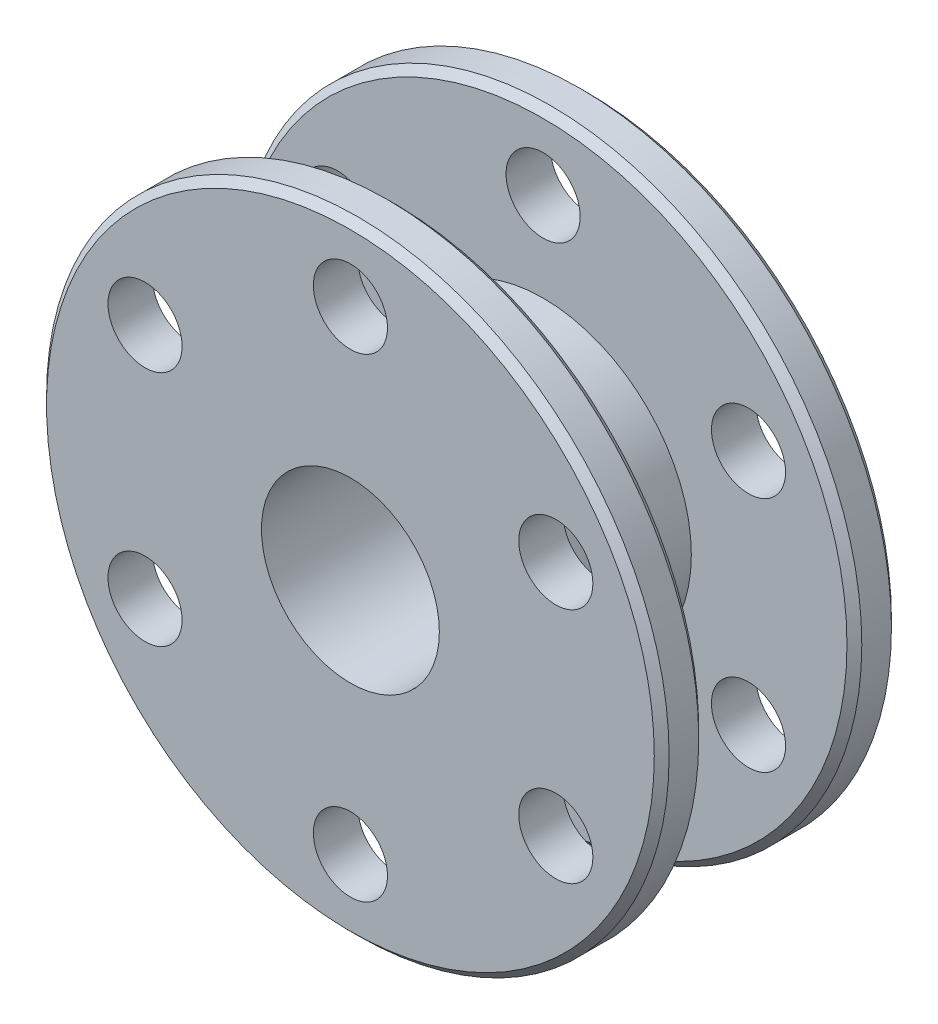
from build123d import *

# Parameters (mm, degrees)
SKETCH1_R           = 10
SKETCH1_R_2         = 6
BOSS_EXTRUDE1_DEPTH = 16
SKETCH1_3_R         = 21
SKETCH1_3_R_2       = 2.5
SKETCH1_3_R_3       = 10
BOSS_EXTRUDE2_DEPTH = 3
CHAMFER1_SIZE       = 0.5


with BuildPart() as part:
    # Sketch1 → Boss-Extrude1 (new body)
    with BuildSketch(Plane.XY):
        Circle(SKETCH1_R)
        Circle(SKETCH1_R_2, mode=Mode.SUBTRACT)
    extrude(amount=BOSS_EXTRUDE1_DEPTH)

    # Sketch1<3> → Boss-Extrude2 (add)
    with BuildSketch(Plane.XY):
        Circle(SKETCH1_3_R)
        with Locations((0, -16)):
            Circle(SKETCH1_3_R_2, mode=Mode.SUBTRACT)
        with Locations((-13.856406461, -8)):
            Circle(SKETCH1_3_R_2, mode=Mode.SUBTRACT)
        with Locations((13.856406461, -8)):
            Circle(SKETCH1_3_R_2, mode=Mode.SUBTRACT)
        with Locations((-13.856406461, 8)):
            Circle(SKETCH1_3_R_2, mode=Mode.SUBTRACT)
        Circle(SKETCH1_3_R_3, mode=Mode.SUBTRACT)
        with Locations((13.856406461, 8)):
            Circle(SKETCH1_3_R_2, mode=Mode.SUBTRACT)
        with Locations((0, 16)):
            Circle(SKETCH1_3_R_2, mode=Mode.SUBTRACT)
    boss_extrude2 = extrude(amount=BOSS_EXTRUDE2_DEPTH)

    # Mirror1: Boss-Extrude2 across plane
    add(boss_extrude2.mirror(Plane(origin=(0, 0, 8), x_dir=(1, 0, 0), z_dir=(0, 0, -1))))

    # Chamfer1
    chamfer1_edges = [part.edges().sort_by_distance(p)[0] for p in [
        (-21, 0, 0),
        (-21, 0, 3),
        (-21, 0, 13),
        (-21, 0, 16),
    ]]
    chamfer(chamfer1_edges, length=CHAMFER1_SIZE)


solid = part.part
